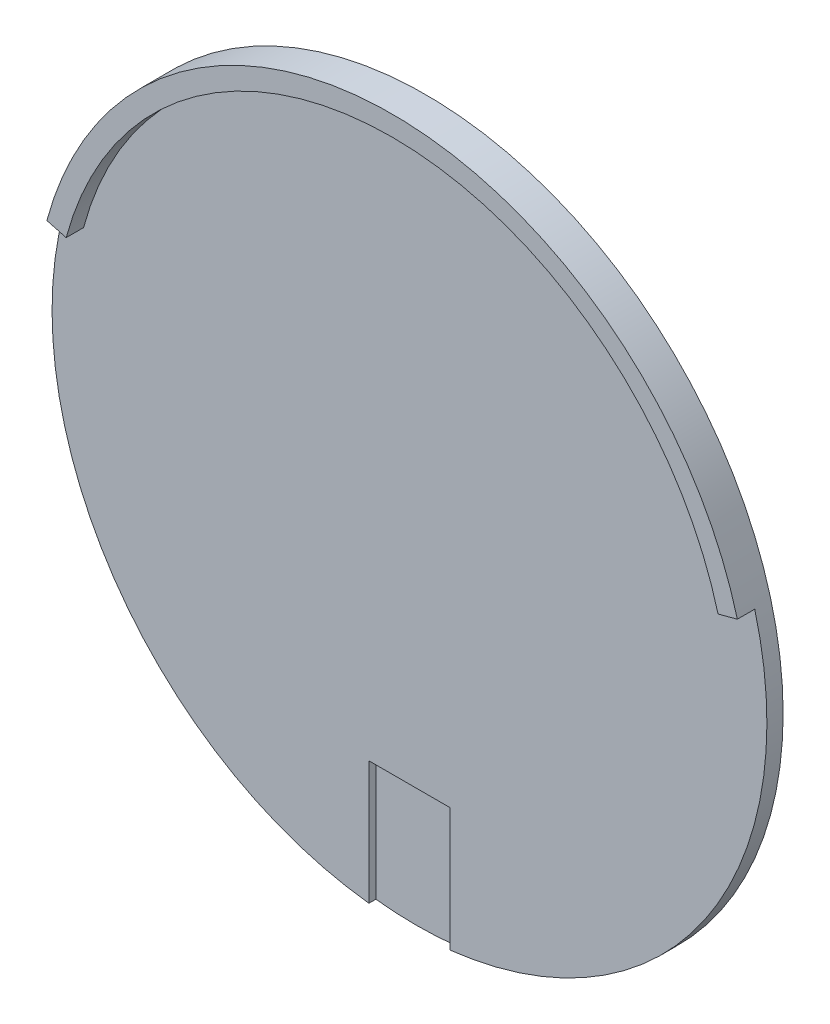
from build123d import *

# Parameters (mm, degrees)
SKETCH1_R                = 61.7
SEAT_DISC_DEPTH          = 2.8
REAR_STOP_ARC_DEPTH      = 3
SKETCH3_W                = 14
SKETCH3_H                = 23
FRONT_DRAIN_GROOVE_DEPTH = 0.85
SKETCH4_R                = 1
PIN_HOLES_DEPTH          = 1.25


with BuildPart() as part:
    # Sketch1 → Seat_disc (new body)
    with BuildSketch(Plane.XY.offset(72)):
        with Locations((70, 0)):
            Circle(SKETCH1_R)
    extrude(amount=SEAT_DISC_DEPTH)

    # Sketch2 → Rear_stop_arc (add)
    with BuildSketch(Plane.XY.offset(74.8)):
        with BuildLine():
            Line((126.265179381, 15.076209377), (129.597623482, 15.969135083))
            ThreePointArc((129.597623482, 15.969135083), (70, 61.7), (10.402376518, 15.969135083))
            Line((10.402376518, 15.969135083), (13.734820619, 15.076209377))
            ThreePointArc((13.734820619, 15.076209377), (70, 58.25), (126.265179381, 15.076209377))
        make_face()
    extrude(amount=REAR_STOP_ARC_DEPTH)

    # Sketch3 → Front_drain_groove (cut, symmetric)
    with BuildSketch(Plane.XY.offset(74.45)):
        with Locations((70, -51.5)):
            Rectangle(SKETCH3_W, SKETCH3_H)
    extrude(amount=FRONT_DRAIN_GROOVE_DEPTH, both=True, mode=Mode.SUBTRACT)

    # Sketch4 → Pin_holes (cut, symmetric)
    with BuildSketch(Plane.XY.offset(72.75)):
        with Locations((70, 50)):
            Circle(SKETCH4_R)
        with Locations((26.698729811, -25)):
            Circle(SKETCH4_R)
        with Locations((113.301270189, -25)):
            Circle(SKETCH4_R)
    extrude(amount=PIN_HOLES_DEPTH, both=True, mode=Mode.SUBTRACT)


solid = part.part
